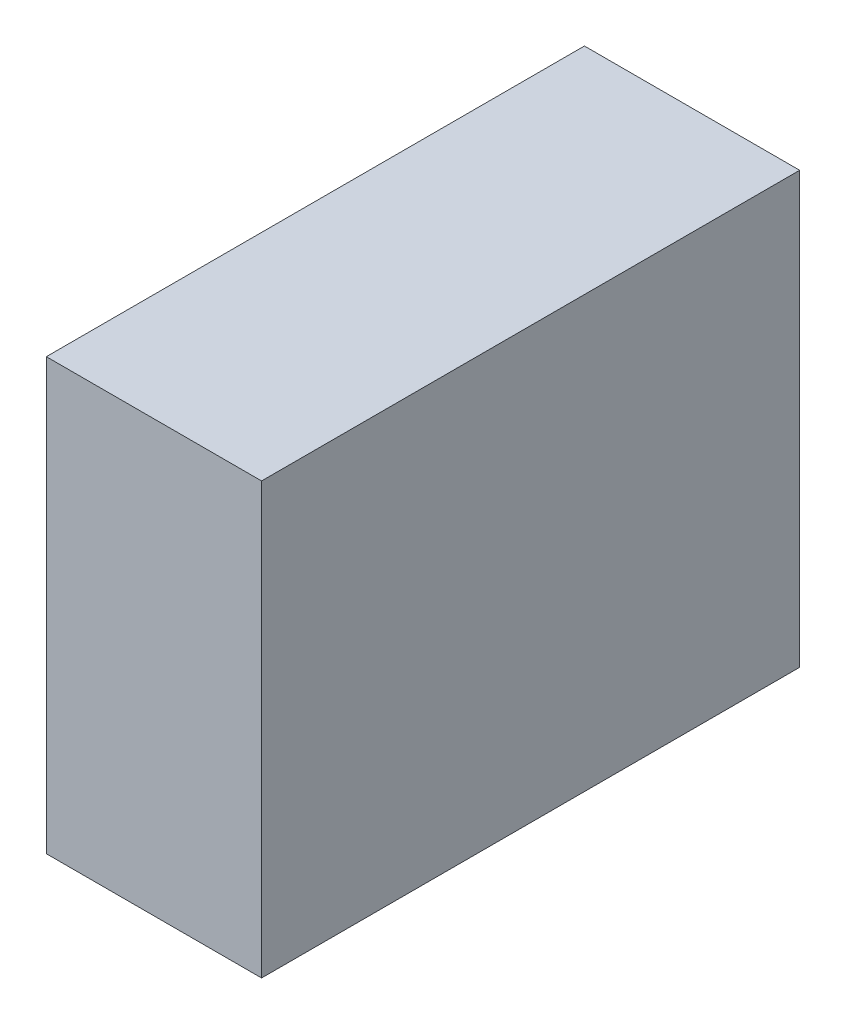
from build123d import *

# Parameters (mm, degrees)
SKETCH1_W           = 203.2
SKETCH1_H           = 406.4
BOSS_EXTRUDE1_DEPTH = 254


with BuildPart() as part:
    # Sketch1 → Boss-Extrude1 (new, symmetric)
    with BuildSketch(Plane.XY):
        Rectangle(SKETCH1_W, SKETCH1_H)
    extrude(amount=BOSS_EXTRUDE1_DEPTH, both=True)


solid = part.part
